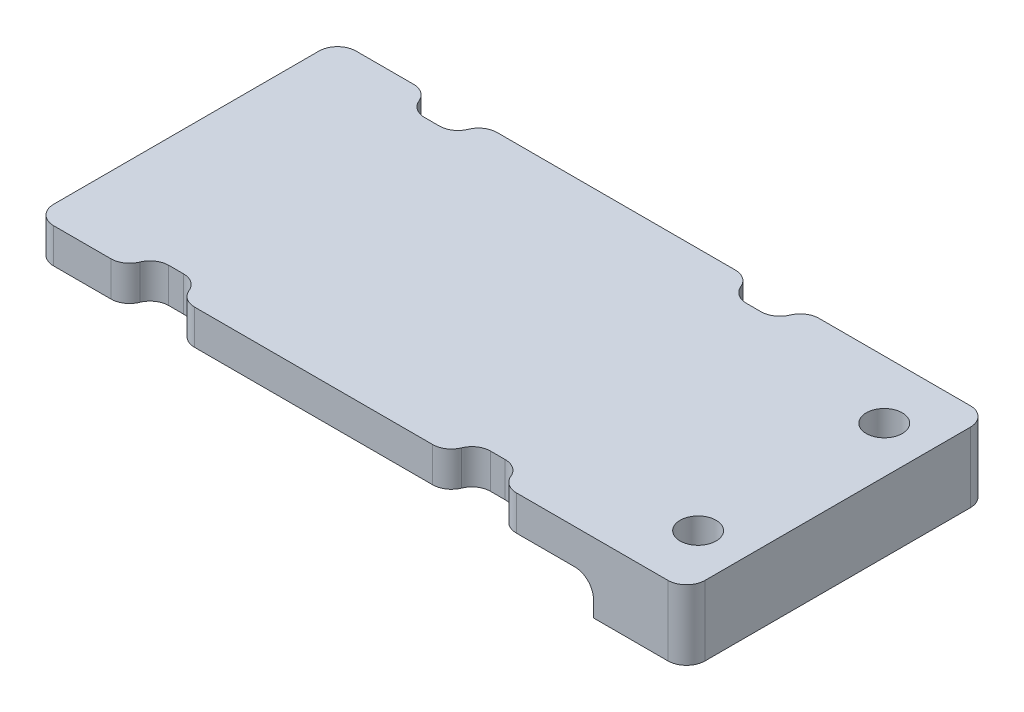
from build123d import *

# Parameters (mm, degrees)
SKETCH1_W                    = 88.9
SKETCH1_H                    = 41.275
BOSS_EXTRUDE1_DEPTH          = 4.7625
SKETCH3_W                    = 12.7
SKETCH3_H                    = 41.275
BOSS_EXTRUDE2_DEPTH          = 4.7625
F_10_0_1935_DIAMETER_HOLE1_D = 4.9149
SKETCH9_W                    = 6.35
SKETCH9_H                    = 3.175
CUT_EXTRUDE1_DEPTH           = 50.924287989
FILLET1_R                    = 2.54
FILLET2_R                    = 2.54


with BuildPart() as part:
    # Sketch1 → Boss-Extrude1 (new body)
    with BuildSketch(Plane(origin=(0, 0, 0), x_dir=(1, 0, 0), z_dir=(0, 1, 0))):
        Rectangle(SKETCH1_W, SKETCH1_H)
    extrude(amount=BOSS_EXTRUDE1_DEPTH)

    # Sketch3 → Boss-Extrude2 (add)
    with BuildSketch(Plane.XZ):
        with Locations((38.1, 0)):
            Rectangle(SKETCH3_W, SKETCH3_H)
    extrude(amount=BOSS_EXTRUDE2_DEPTH)

    # #10 (0.1935) Diameter Hole1 (through all)
    with Locations(Plane(origin=(0, 4.7625, 0), x_dir=(1, 0, 0), z_dir=(0, 1, 0))):
        with Locations((38.1, 12.7), (38.1, -12.7)):
            Hole(F_10_0_1935_DIAMETER_HOLE1_D / 2)

    # Sketch9 → Cut-Extrude1 (cut, through all)
    with BuildSketch(Plane(origin=(0, 4.7625, 0), x_dir=(1, 0, 0), z_dir=(0, 1, 0))):
        with Locations((15.534707564, 19.05)):
            Rectangle(SKETCH9_W, SKETCH9_H)
        with Locations((-28.3765625, 19.05)):
            Rectangle(SKETCH9_W, SKETCH9_H)
        with Locations((-28.3765625, -19.05)):
            Rectangle(SKETCH9_W, SKETCH9_H)
        with Locations((15.534707564, -19.05)):
            Rectangle(SKETCH9_W, SKETCH9_H)
    extrude(amount=-CUT_EXTRUDE1_DEPTH, mode=Mode.SUBTRACT)

    # Fillet1
    fillet1_edges = [part.edges().sort_by_distance(p)[0] for p in [
        (31.75, 0, 0),
        (12.359707564, 2.38125, 20.6375),
        (18.709707564, 2.38125, 20.6375),
        (-31.5515625, 2.38125, 20.6375),
        (-25.2015625, 2.38125, 20.6375),
        (44.45, 0, 20.6375),
        (-44.45, 2.38125, 20.6375),
        (-31.5515625, 2.38125, -20.6375),
        (-25.2015625, 2.38125, -20.6375),
        (-44.45, 2.38125, -20.6375),
        (44.45, 0, -20.6375),
        (12.359707564, 2.38125, -20.6375),
        (18.709707564, 2.38125, -20.6375),
    ]]
    fillet(fillet1_edges, radius=FILLET1_R)

    # Fillet2
    fillet2_edges = [part.edges().sort_by_distance(p)[0] for p in [
        (18.709707564, 2.38125, -17.4625),
        (12.359707564, 2.38125, -17.4625),
        (-31.5515625, 2.38125, -17.4625),
        (-25.2015625, 2.38125, -17.4625),
        (-25.2015625, 2.38125, 17.4625),
        (-31.5515625, 2.38125, 17.4625),
        (12.359707564, 2.38125, 17.4625),
        (18.709707564, 2.38125, 17.4625),
    ]]
    fillet(fillet2_edges, radius=FILLET2_R)


solid = part.part
